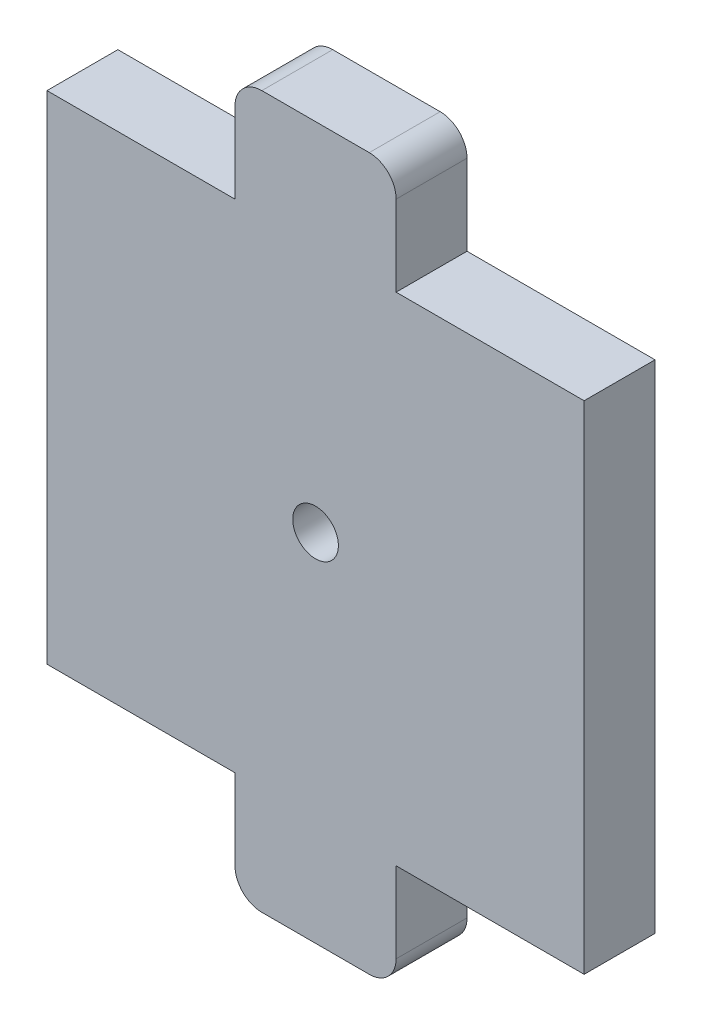
from build123d import *

# Parameters (mm, degrees)
MODEL_R             = 2.125
BOSS_EXTRUDE1_DEPTH = 6.6


with BuildPart() as part:
    # Model → Boss-Extrude1 (new body)
    with BuildSketch(Plane.XY):
        with BuildLine():
            Line((-25, 23.12), (-25, -23.12))
            Line((-25, -23.12), (-7.5, -23.12))
            Line((-7.5, -23.12), (-7.5, -30.62))
            ThreePointArc((-7.5, -30.62), (-6.767766953, -32.387766953), (-5, -33.12))
            Line((-5, -33.12), (5, -33.12))
            ThreePointArc((5, -33.12), (6.767766953, -32.387766953), (7.5, -30.62))
            Line((7.5, -30.62), (7.5, -23.12))
            Line((7.5, -23.12), (25, -23.12))
            Line((25, -23.12), (25, 23.12))
            Line((25, 23.12), (7.5, 23.12))
            Line((7.5, 23.12), (7.5, 30.62))
            ThreePointArc((7.5, 30.62), (6.767766953, 32.387766953), (5, 33.12))
            Line((5, 33.12), (-5, 33.12))
            ThreePointArc((-5, 33.12), (-6.767766953, 32.387766953), (-7.5, 30.62))
            Line((-7.5, 30.62), (-7.5, 23.12))
            Line((-7.5, 23.12), (-25, 23.12))
        make_face()
        Circle(MODEL_R, mode=Mode.SUBTRACT)
    extrude(amount=BOSS_EXTRUDE1_DEPTH)


solid = part.part
